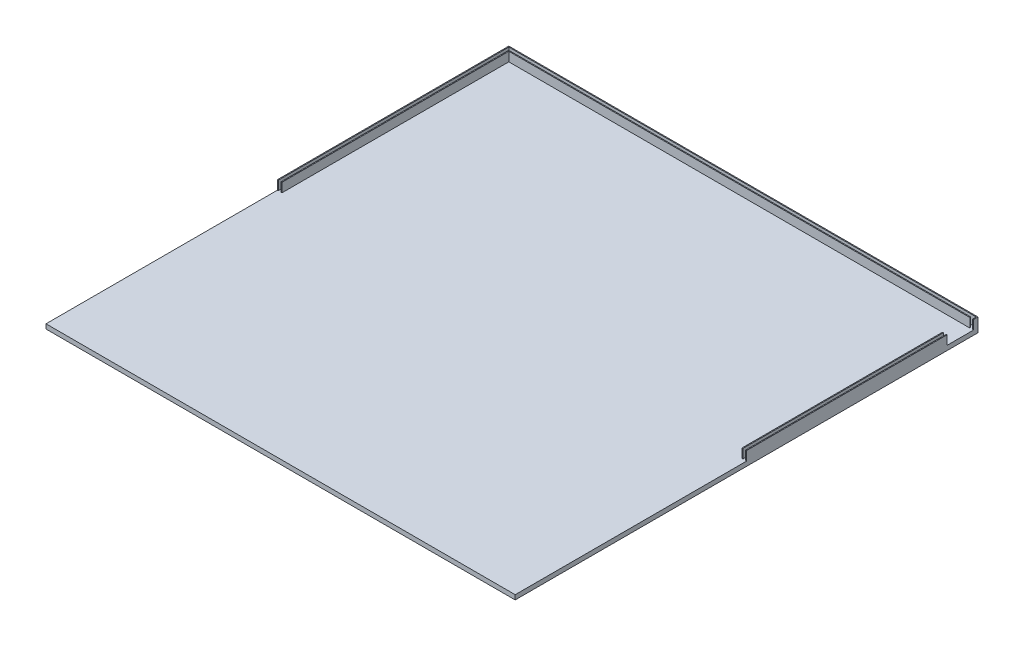
from build123d import *

# Parameters (mm, degrees)
ESBO_O1_W                = 514
ESBO_O1_H                = 507
RESSALTO_EXTRUS_O1_DEPTH = 5
ESBO_O2_W                = 5
ESBO_O2_H                = 253.5
RESSALTO_EXTRUS_O2_DEPTH = 10
ESBO_O6_W                = 5
ESBO_O6_H                = 253.5
RESSALTO_EXTRUS_O3_DEPTH = 10
ESBO_O7_W                = 3
ESBO_O7_H                = 253.5
CORTE_EXTRUS_O1_DEPTH    = 10
ESBO_O9_W                = 3
ESBO_O9_H                = 253.5
CORTE_EXTRUS_O3_DEPTH    = 10
ESBO_O10_W               = 514
ESBO_O10_H               = 5
RESSALTO_EXTRUS_O4_DEPTH = 10
ESBO_O15_W               = 512
ESBO_O15_H               = 3
CORTE_EXTRUS_O11_DEPTH   = 10
ESBO_O16_W               = 3
ESBO_O16_H               = 1
CORTE_EXTRUS_O12_DEPTH   = 10
ESBO_O20_R               = 15
RESSALTO_EXTRUS_O5_DEPTH = 10
ESBO_O21_W               = 1
ESBO_O21_H               = 29
CORTE_EXTRUS_O13_DEPTH   = 10


with BuildPart() as part:
    # Esboço1 → Ressalto-extrusão1 (new body)
    with BuildSketch(Plane(origin=(0, 0, 0), x_dir=(1, 0, 0), z_dir=(0, 1, 0))):
        with Locations((159.395426849, -182.414405214)):
            Rectangle(ESBO_O1_W, ESBO_O1_H)
    extrude(amount=RESSALTO_EXTRUS_O1_DEPTH)

    # Esboço2 → Ressalto-extrusão2 (add)
    with BuildSketch(Plane(origin=(0, 5, 0), x_dir=(1, 0, 0), z_dir=(0, 1, 0))):
        with Locations((-95.104573151, -55.664405214)):
            Rectangle(ESBO_O2_W, ESBO_O2_H)
    extrude(amount=RESSALTO_EXTRUS_O2_DEPTH)

    # Esboço6 → Ressalto-extrusão3 (add)
    with BuildSketch(Plane(origin=(0, 5, 0), x_dir=(1, 0, 0), z_dir=(0, 1, 0))):
        with Locations((413.895426849, -55.664405214)):
            Rectangle(ESBO_O6_W, ESBO_O6_H)
    extrude(amount=RESSALTO_EXTRUS_O3_DEPTH)

    # Esboço7 → Corte-extrusão1 (cut)
    with BuildSketch(Plane(origin=(0, 15, 0), x_dir=(1, 0, 0), z_dir=(0, 1, 0))):
        with Locations((-95.104573151, -55.664405214)):
            Rectangle(ESBO_O7_W, ESBO_O7_H)
    extrude(amount=-CORTE_EXTRUS_O1_DEPTH, mode=Mode.SUBTRACT)

    # Esboço9 → Corte-extrusão3 (cut)
    with BuildSketch(Plane(origin=(0, 15, 0), x_dir=(1, 0, 0), z_dir=(0, 1, 0))):
        with Locations((413.895426849, -55.664405214)):
            Rectangle(ESBO_O9_W, ESBO_O9_H)
    extrude(amount=-CORTE_EXTRUS_O3_DEPTH, mode=Mode.SUBTRACT)

    # Esboço10 → Ressalto-extrusão4 (add)
    with BuildSketch(Plane(origin=(0, 5, 0), x_dir=(1, 0, 0), z_dir=(0, 1, 0))):
        with Locations((159.395426849, 68.585594786)):
            Rectangle(ESBO_O10_W, ESBO_O10_H)
    extrude(amount=RESSALTO_EXTRUS_O4_DEPTH)

    # Esboço15 → Corte-extrusão11 (cut)
    with BuildSketch(Plane(origin=(0, 15, 0), x_dir=(1, 0, 0), z_dir=(0, 1, 0))):
        with Locations((159.395426849, 68.585594786)):
            Rectangle(ESBO_O15_W, ESBO_O15_H)
    extrude(amount=-CORTE_EXTRUS_O11_DEPTH, mode=Mode.SUBTRACT)

    # Esboço16 → Corte-extrusão12 (cut)
    with BuildSketch(Plane(origin=(0, 15, 0), x_dir=(1, 0, 0), z_dir=(0, 1, 0))):
        with Locations((413.895426849, 66.585594786)):
            Rectangle(ESBO_O16_W, ESBO_O16_H)
        with Locations((-95.104573151, 66.585594786)):
            Rectangle(ESBO_O16_W, ESBO_O16_H)
    extrude(amount=-CORTE_EXTRUS_O12_DEPTH, mode=Mode.SUBTRACT)

    # Esboço20 → Ressalto-extrusão5 (add)
    with BuildSketch(Plane.XZ):
        with Locations(Location((-47.604573151, 385.914405214, 0), (0, 0, 90))):
            Circle(ESBO_O20_R)
        with Locations(Location((366.395426849, 385.914405214, 0), (0, 0, 90))):
            Circle(ESBO_O20_R)
        with Locations(Location((366.395426849, -21.085594786, 0), (0, 0, 90))):
            Circle(ESBO_O20_R)
        with Locations(Location((-47.604573151, -21.085594786, 0), (0, 0, 90))):
            Circle(ESBO_O20_R)
    extrude(amount=RESSALTO_EXTRUS_O5_DEPTH)

    # Esboço21 → Corte-extrusão13 (cut)
    with BuildSketch(Plane(origin=(0, 15, 0), x_dir=(1, 0, 0), z_dir=(0, 1, 0))):
        with Locations((411.895426849, 51.585594786)):
            Rectangle(ESBO_O21_W, ESBO_O21_H)
        with Locations((415.895426849, 51.585594786)):
            Rectangle(ESBO_O21_W, ESBO_O21_H)
    extrude(amount=-CORTE_EXTRUS_O13_DEPTH, mode=Mode.SUBTRACT)


solid = part.part
